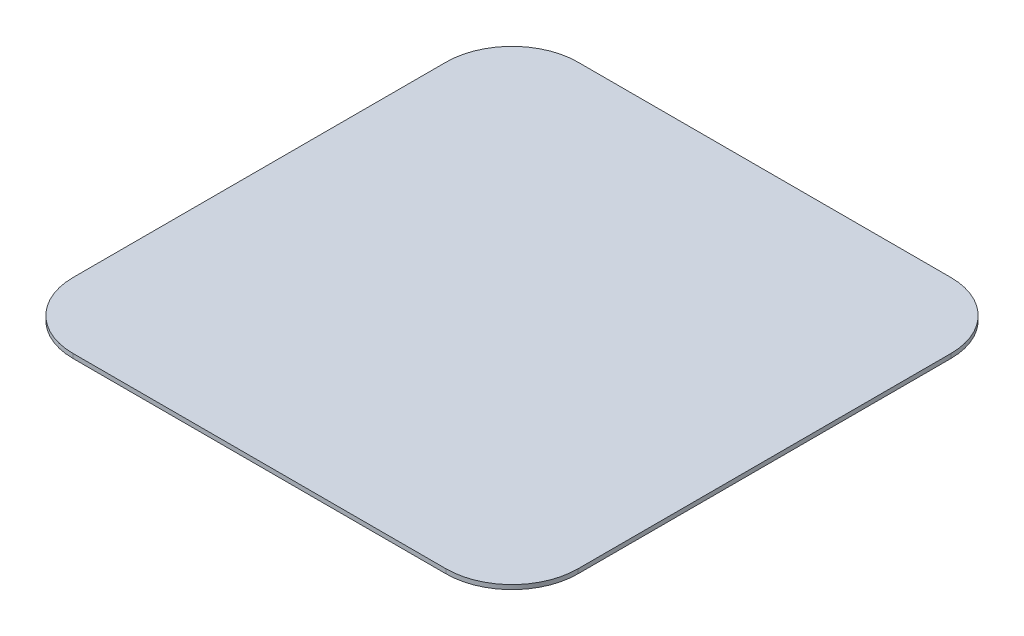
from build123d import *

# Parameters (mm, degrees)
SKETCH1_W           = 230
SKETCH1_H           = 230
BOSS_EXTRUDE1_DEPTH = 2
FILLET1_R           = 30


with BuildPart() as part:
    # Sketch1 → Boss-Extrude1 (new body)
    with BuildSketch(Plane(origin=(0, 0, 0), x_dir=(1, 0, 0), z_dir=(0, 1, 0))):
        Rectangle(SKETCH1_W, SKETCH1_H)
    extrude(amount=BOSS_EXTRUDE1_DEPTH)

    # Fillet1
    fillet1_edges = [part.edges().sort_by_distance(p)[0] for p in [
        (115, 1, 115),
        (-115, 1, 115),
        (-115, 1, -115),
        (115, 1, -115),
    ]]
    fillet(fillet1_edges, radius=FILLET1_R)


solid = part.part
